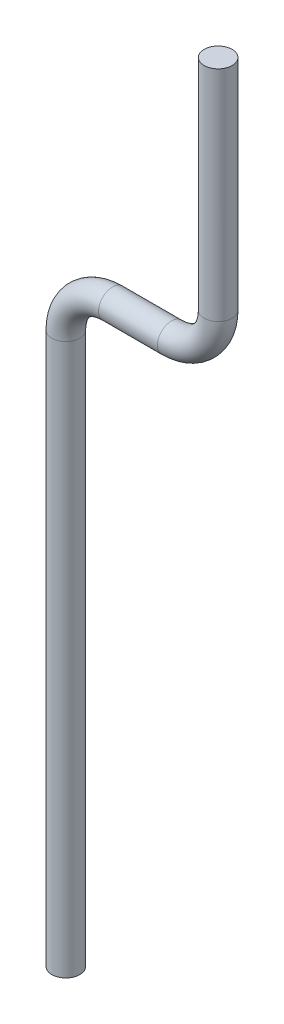
from build123d import *

# Parameters (mm, degrees)
SKETCH2_R = 1.5


with BuildPart() as part:
    # Sweep1: sweep along a path in Sketch1
    with BuildLine(Plane.XY) as sweep1_path:
        Line((0, 0), (0, -23.42939458))
        ThreePointArc((0, -23.42939458), (-1.464466094, -26.964928486), (-5, -28.42939458))
        Line((-5, -28.42939458), (-11.30481531, -28.42939458))
        ThreePointArc((-11.30481531, -28.42939458), (-14.840349216, -29.893860674), (-16.30481531, -33.42939458))
        Line((-16.30481531, -33.42939458), (-16.30481531, -92.431947728))
    # Sketch2 → Sweep1 (sweep)
    with BuildSketch(Plane(origin=(0, 0, 0), x_dir=(1, 0, 0), z_dir=(0, 1, 0))):
        Circle(SKETCH2_R)
    sweep(path=sweep1_path.line)


solid = part.part
